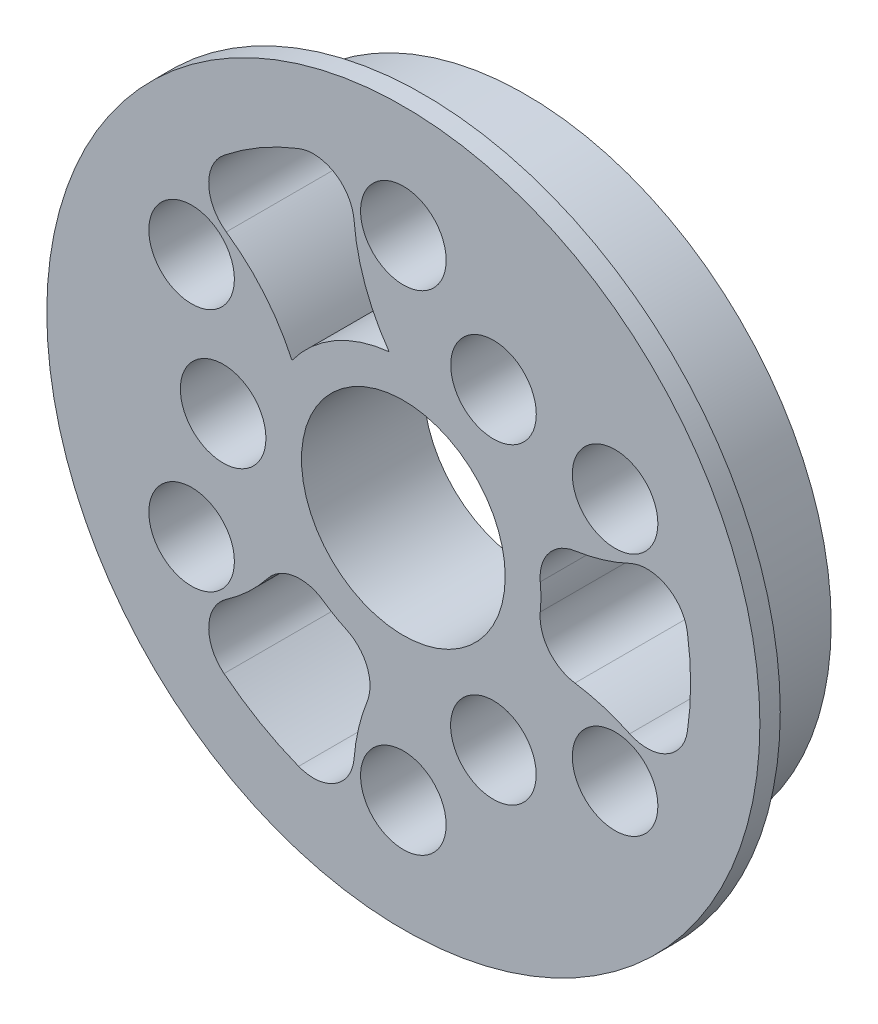
from build123d import *

# Parameters (mm, degrees)
SKETCH_1_R          = 15
SKETCH_1_R_2        = 2.1
EXTRUDE_1_DEPTH     = 6
EXTRUDE_START       = -1
SKETCH_2_R          = 17.5
SKETCH_2_R_2        = 2.1
EXTRUDE_2_DEPTH     = 1
SKETCH_3_R          = 5
CUT_EXTRUDE_1_DEPTH = 10
CUT_EXTRUDE_3_DEPTH = 10
FILLET_1_R          = 2


with BuildPart() as part:
    # 草图1 → 凸台-拉伸1 (new body)
    with BuildSketch(Plane.XY):
        Circle(SKETCH_1_R)
        with Locations((0, 12)):
            Circle(SKETCH_1_R_2, mode=Mode.SUBTRACT)
        with Locations((10.392304845, 6)):
            Circle(SKETCH_1_R_2, mode=Mode.SUBTRACT)
        with Locations((10.392304845, -6)):
            Circle(SKETCH_1_R_2, mode=Mode.SUBTRACT)
        with Locations((0, -12)):
            Circle(SKETCH_1_R_2, mode=Mode.SUBTRACT)
        with Locations((-10.392304845, -6)):
            Circle(SKETCH_1_R_2, mode=Mode.SUBTRACT)
        with Locations((-10.392304845, 6)):
            Circle(SKETCH_1_R_2, mode=Mode.SUBTRACT)
        with Locations((4.425, 7.664324823)):
            Circle(SKETCH_1_R_2, mode=Mode.SUBTRACT)
        with Locations((4.419693866, -7.655134331)):
            Circle(SKETCH_1_R_2, mode=Mode.SUBTRACT)
        with Locations((-8.844693866, 0.009190493)):
            Circle(SKETCH_1_R_2, mode=Mode.SUBTRACT)
    extrude(amount=EXTRUDE_1_DEPTH)

    # 草图2 → 凸台-拉伸2 (add)
    with BuildSketch(Plane.XY.offset(6).offset(EXTRUDE_START)):
        Circle(SKETCH_2_R)
        with Locations((-8.844693866, 0.009190493)):
            Circle(SKETCH_2_R_2, mode=Mode.SUBTRACT)
        with Locations((-10.392304845, -6)):
            Circle(SKETCH_2_R_2, mode=Mode.SUBTRACT)
        with Locations((0, -12)):
            Circle(SKETCH_2_R_2, mode=Mode.SUBTRACT)
        with Locations((4.419693866, -7.655134331)):
            Circle(SKETCH_2_R_2, mode=Mode.SUBTRACT)
        with Locations((10.392304845, -6)):
            Circle(SKETCH_2_R_2, mode=Mode.SUBTRACT)
        with Locations((10.392304845, 6)):
            Circle(SKETCH_2_R_2, mode=Mode.SUBTRACT)
        with Locations((4.425, 7.664324823)):
            Circle(SKETCH_2_R_2, mode=Mode.SUBTRACT)
        with Locations((0, 12)):
            Circle(SKETCH_2_R_2, mode=Mode.SUBTRACT)
        with Locations((-10.392304845, 6)):
            Circle(SKETCH_2_R_2, mode=Mode.SUBTRACT)
    extrude(amount=EXTRUDE_2_DEPTH)

    # 草图3 → 切除-拉伸1 (cut)
    with BuildSketch(Plane.XY.offset(6)):
        Circle(SKETCH_3_R)
    extrude(amount=-CUT_EXTRUDE_1_DEPTH, mode=Mode.SUBTRACT)

    # 草图4 → 切除-拉伸3 (cut)
    with BuildSketch(Plane(origin=(0, 0, 0), x_dir=(-1, 0, 0), z_dir=(0, 0, -1))):
        with BuildLine():
            ThreePointArc((5.465336879, 3.961387736), (7.679309109, 7.001766097), (10.89964539, 8.94470404))
            ThreePointArc((10.89964539, 8.94470404), (7.05, 12.210958193), (2.296518233, 13.91172182))
            ThreePointArc((2.296518233, 13.91172182), (2.224052757, 10.151359821), (0.697993974, 6.713814446))
            ThreePointArc((0.697993974, 6.713814446), (3.375, 5.845671476), (5.465336879, 3.961387736))
        make_face()
        with BuildLine():
            ThreePointArc((2.296518233, -13.91172182), (7.05, -12.210958193), (10.89964539, -8.94470404))
            ThreePointArc((10.89964539, -8.94470404), (7.679309109, -7.001766097), (5.465336879, -3.961387736))
            ThreePointArc((5.465336879, -3.961387736), (3.375, -5.845671476), (0.697993974, -6.713814446))
            ThreePointArc((0.697993974, -6.713814446), (2.224052757, -10.151359821), (2.296518233, -13.91172182))
        make_face()
        with BuildLine():
            ThreePointArc((-6.163330853, 2.75242671), (-9.903361866, 3.149593723), (-13.196163623, 4.96701778))
            ThreePointArc((-13.196163623, 4.96701778), (-14.1, 0), (-13.196163623, -4.96701778))
            ThreePointArc((-13.196163623, -4.96701778), (-9.903361866, -3.149593723), (-6.163330853, -2.75242671))
            ThreePointArc((-6.163330853, -2.75242671), (-6.75, 0), (-6.163330853, 2.75242671))
        make_face()
    extrude(amount=-CUT_EXTRUDE_3_DEPTH, mode=Mode.SUBTRACT)

    # 圆角1
    fillet_1_edges = [part.edges().sort_by_distance(p)[0] for p in [
        (-10.89964539, 8.94470404, 3),
        (-2.296518233, 13.91172182, 3),
        (-2.296518233, -13.91172182, 3),
        (-0.697993974, -6.713814446, 3),
        (-5.465336879, -3.961387736, 3),
        (-10.89964539, -8.94470404, 3),
        (6.163330853, -2.75242671, 3),
        (13.196163623, -4.96701778, 3),
        (13.196163623, 4.96701778, 3),
        (6.163330853, 2.75242671, 3),
    ]]
    fillet(fillet_1_edges, radius=FILLET_1_R)


solid = part.part
